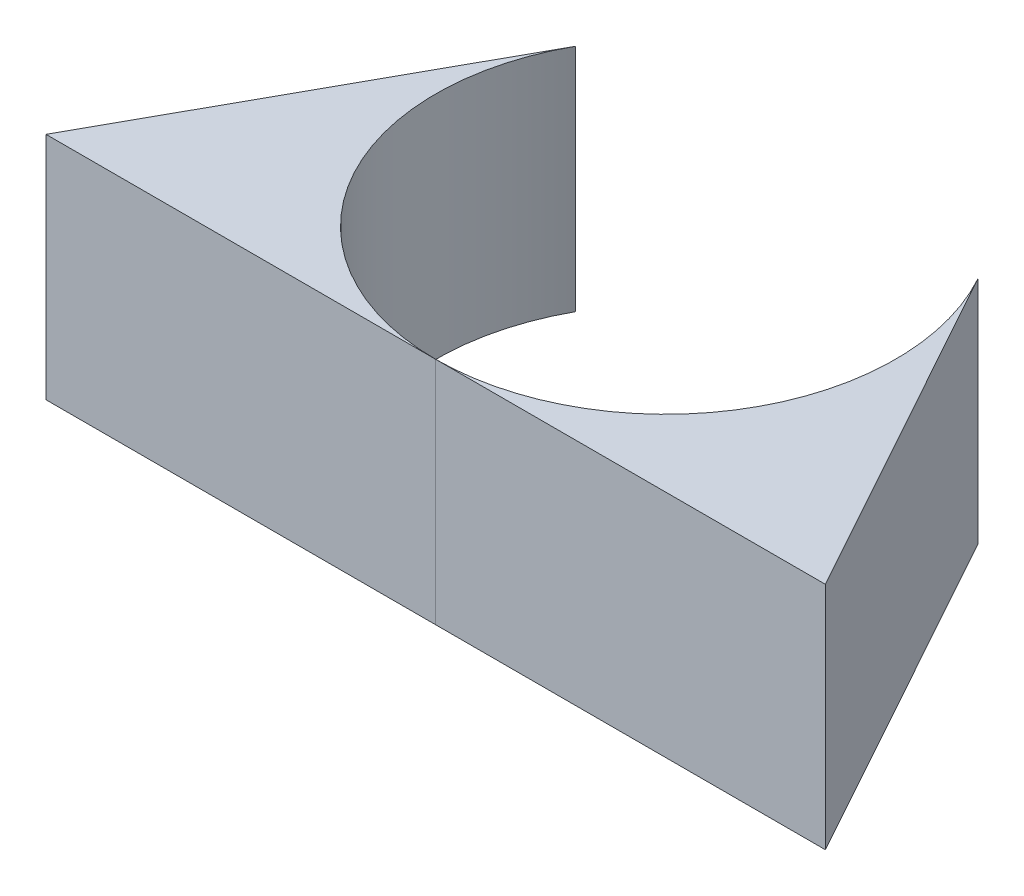
from build123d import *

# Parameters (mm, degrees)
BOSS_EXTRUDE1_DEPTH   = 3.175
BOSS_EXTRUDE1_2_DEPTH = 3.175


with BuildPart() as part:
    # Sketch1 → Boss-Extrude1 (new body)
    with BuildSketch(Plane(origin=(0, 0, 0), x_dir=(1, 0, 0), z_dir=(0, 1, 0))):
        with BuildLine():
            Line((-10.763873207, 0), (-5.381936603, 0))
            ThreePointArc((-5.381936603, 0), (-8.116542678, 1.561756492), (-8.160888098, 4.710595517))
            Line((-8.160888098, 4.710595517), (-10.763873207, 0))
        make_face()
    extrude(amount=BOSS_EXTRUDE1_DEPTH)


with BuildPart() as body_2:
    # Sketch1 → Boss-Extrude1 2 (new body)
    with BuildSketch(Plane(origin=(0, 0, 0), x_dir=(1, 0, 0), z_dir=(0, 1, 0))):
        with BuildLine():
            Line((-5.381936603, 0), (0, 0))
            Line((0, 0), (-2.602985109, 4.710595517))
            ThreePointArc((-2.602985109, 4.710595517), (-2.647330529, 1.561756492), (-5.381936603, 0))
        make_face()
    extrude(amount=BOSS_EXTRUDE1_2_DEPTH)


solid = Compound([part.part, body_2.part])
